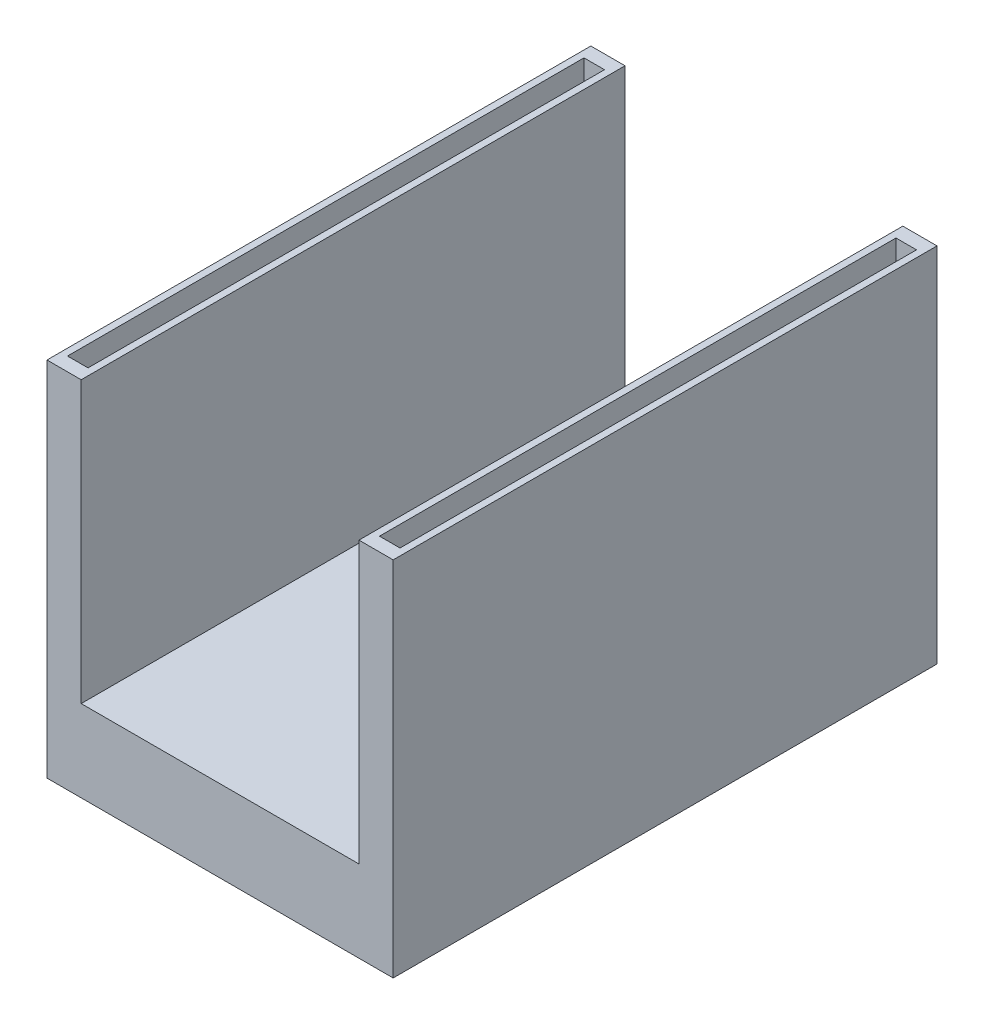
from build123d import *

# Parameters (mm, degrees)
BOSS_EXTRUDE2_DEPTH = 159
SKETCH4_W           = 6
SKETCH4_H           = 151
CUT_EXTRUDE1_DEPTH  = 20


with BuildPart() as part:
    # Sketch3 → Boss-Extrude2 (new body)
    with BuildSketch(Plane.XY):
        Polygon((0, 0), (0, 105.870341046), (10, 105.870341046), (10, 23.872751767), (91.212923353, 23.872751767), (91.212923353, 105.870341046), (101.212923353, 105.870341046), (101.212923353, 0), align=None)
    extrude(amount=BOSS_EXTRUDE2_DEPTH)

    # Sketch4 → Cut-Extrude1 (cut)
    with BuildSketch(Plane(origin=(0, 105.870341046, 0), x_dir=(1, 0, 0), z_dir=(0, 1, 0))):
        with Locations((5, -79.5)):
            Rectangle(SKETCH4_W, SKETCH4_H)
        with Locations((96.212923353, -79.5)):
            Rectangle(SKETCH4_W, SKETCH4_H)
    extrude(amount=-CUT_EXTRUDE1_DEPTH, mode=Mode.SUBTRACT)


solid = part.part
